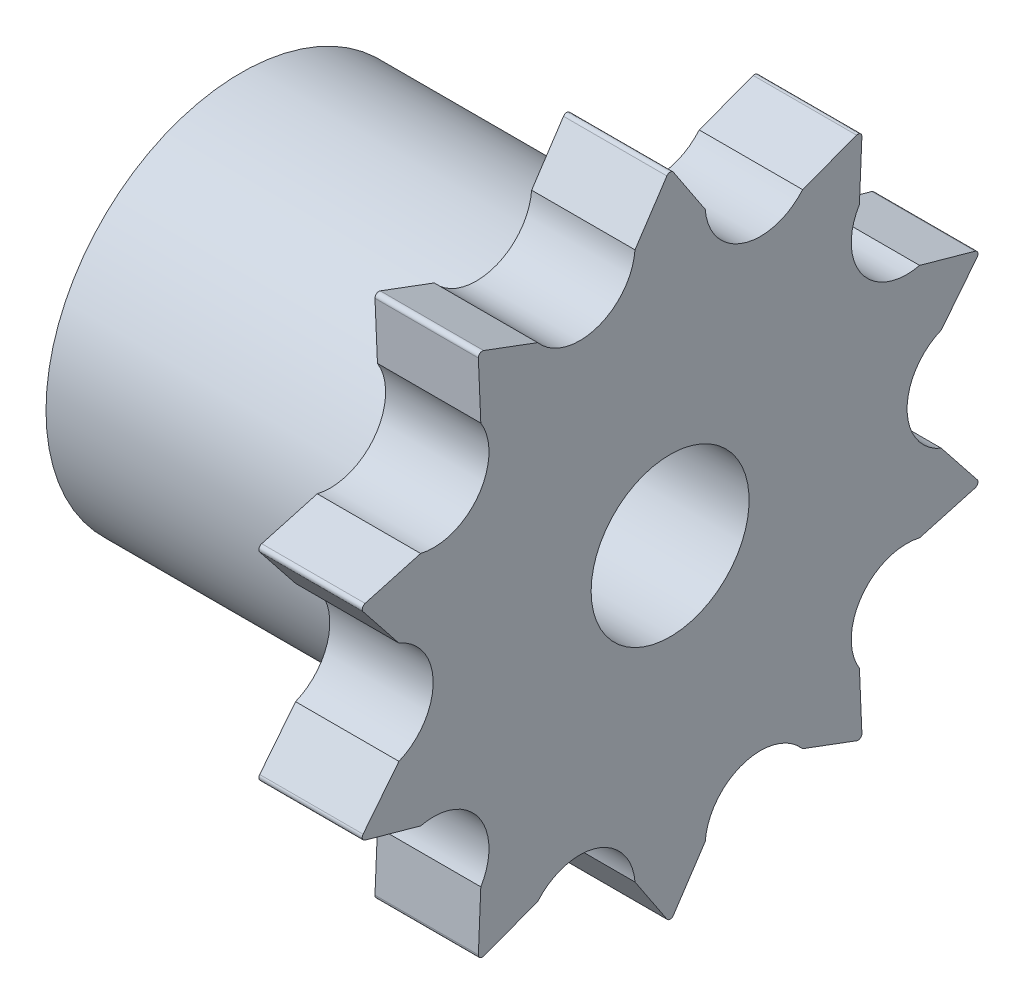
from build123d import *

# Parameters (mm, degrees)
BOSS_EXTRUDE1_DEPTH     = 5.3
CIRPATTERN1_COUNT       = 10
FILLET1_R               = 0.2
FILLET3_R               = 0.2
SKETCH2_R               = 10
SKETCH2_R_2             = 4.05
BOSS_EXTRUDE2_DEPTH     = 16.7
CUT_EXTRUDE1_DEPTH      = 29.341701561
CUT_EXTRUDE1_DEPTH_BACK = 29.341701561
SKETCH2_2_R             = 4.05


with BuildPart() as part:
    # Sketch1 → Boss-Extrude1 (new body)
    with BuildSketch(Plane(origin=(0, 0, 0), x_dir=(0, 0, -1), z_dir=(1, 0, 0))):
        with BuildLine():
            Line((0, 0), (9.845402976, 13.551034656))
            Line((9.845402976, 13.551034656), (6.793214092, 12.412684734))
            ThreePointArc((6.793214092, 12.412684734), (3.754556482, 11.555336673), (1.800167381, 14.035023954))
            Line((1.800167381, 14.035023954), (0, 16.75))
            Line((0, 16.75), (0, 0))
        make_face()
    boss_extrude1 = extrude(amount=BOSS_EXTRUDE1_DEPTH)

    # CirPattern1: Boss-Extrude1 ×10 about axis
    cirpattern1_axis = Axis((5.3, 0, 0), (-1, 0, 0))
    for i in range(1, CIRPATTERN1_COUNT):
        add(boss_extrude1.rotate(cirpattern1_axis, i * 360 / CIRPATTERN1_COUNT))

    # Fillet1
    fillet1_edges = [part.edges().sort_by_distance(p)[0] for p in [
        (2.65, 16.75, 0),
    ]]
    fillet(fillet1_edges, radius=FILLET1_R)

    # Fillet3
    fillet3_edges = [part.edges().sort_by_distance(p)[0] for p in [
        (2.65, 13.551034656, 9.845402976),
        (2.65, 5.176034656, 15.930196648),
        (2.65, -5.176034656, 15.930196648),
        (2.65, -13.551034656, 9.845402976),
        (2.65, -16.75, 0),
        (2.65, -13.551034656, -9.845402976),
        (2.65, -5.176034656, -15.930196648),
        (2.65, 5.176034656, -15.930196648),
        (2.65, 13.551034656, -9.845402976),
    ]]
    fillet(fillet3_edges, radius=FILLET3_R)

    # Sketch2 → Boss-Extrude2 (add)
    with BuildSketch(Plane.ZY):
        Circle(SKETCH2_R)
        Circle(SKETCH2_R_2, mode=Mode.SUBTRACT)
    extrude(amount=BOSS_EXTRUDE2_DEPTH)

    # Sketch2<2> → Cut-Extrude1 (cut, two sides: drawn at the far end of the back side and taken through both)
    with BuildSketch(Plane.ZY.offset(-CUT_EXTRUDE1_DEPTH_BACK)):
        Circle(SKETCH2_2_R)
    extrude(amount=CUT_EXTRUDE1_DEPTH + CUT_EXTRUDE1_DEPTH_BACK, mode=Mode.SUBTRACT)


solid = part.part
